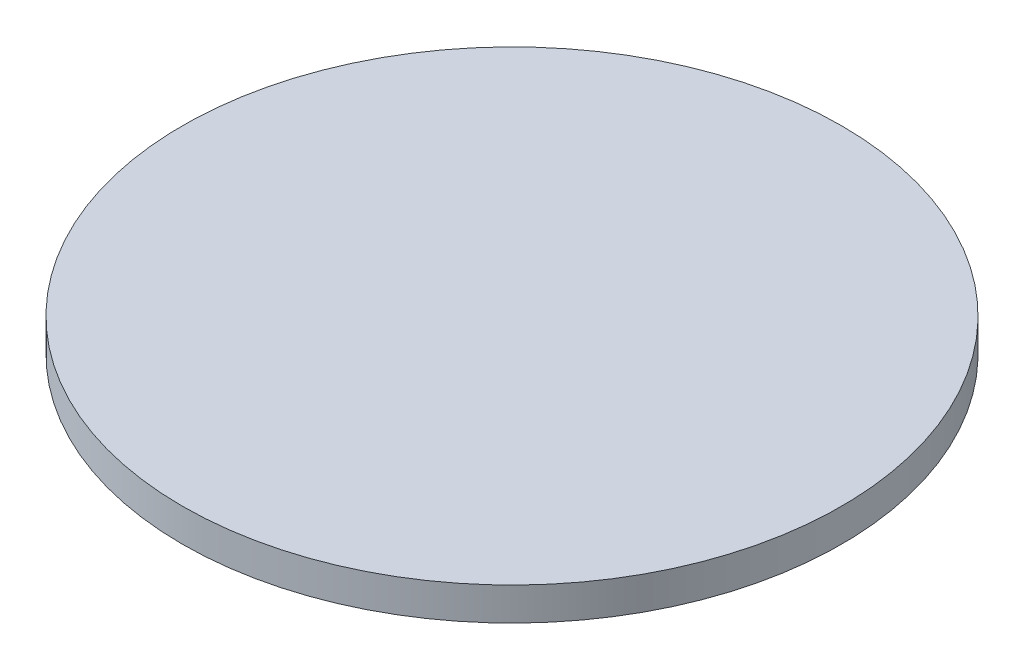
from build123d import *

# Parameters (mm, degrees)
SKETCH_1_R      = 20
EXTRUDE_1_DEPTH = 2


with BuildPart() as part:
    # 草图1 → 凸台-拉伸1 (new body)
    with BuildSketch(Plane(origin=(0, 0, 0), x_dir=(1, 0, 0), z_dir=(0, 1, 0))):
        with Locations(Location((0, 0, 0), (0, 0, 270))):
            Circle(SKETCH_1_R)
    extrude(amount=EXTRUDE_1_DEPTH)


solid = part.part
